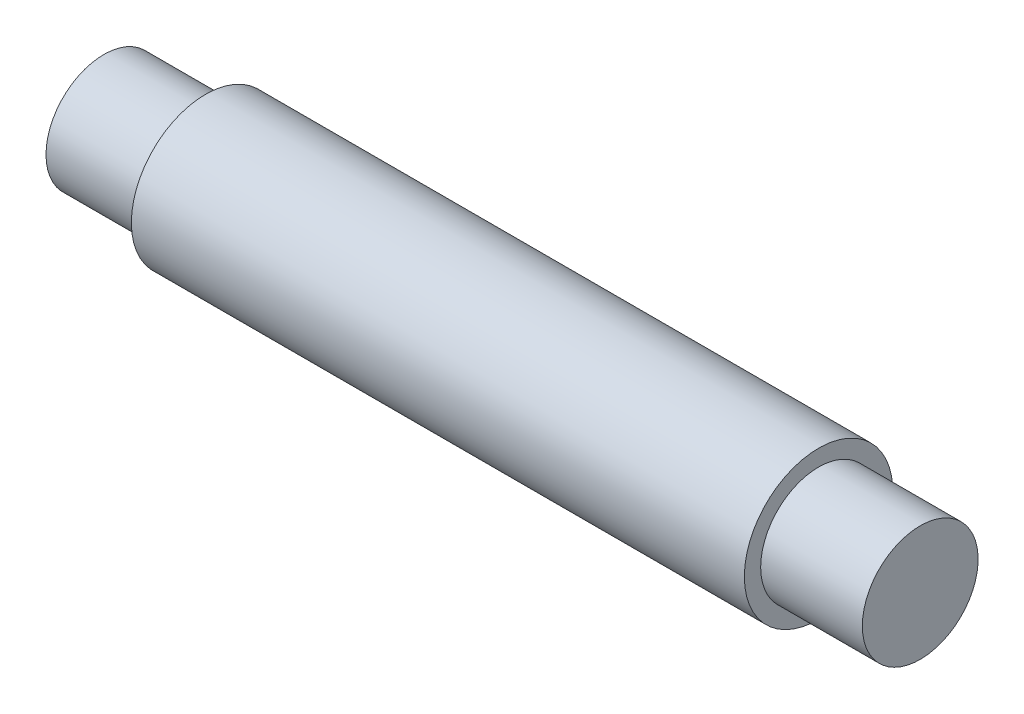
from build123d import *

# Parameters (mm, degrees)
SKETCH1_W = 6.85
SKETCH1_H = 3.9


with BuildPart() as part:
    # Sketch1 → Revolve1 (revolve)
    with BuildSketch(Plane.XY, mode=Mode.PRIVATE) as revolve1_sk:
        Polygon((20.65, 5), (-20.65, 5), (-20.65, 3.9), (-20.65, 0), (20.65, 0), (20.65, 3.9), align=None)
        with Locations((-24.075, 1.95)):
            Rectangle(SKETCH1_W, SKETCH1_H)
        with Locations((24.075, 1.95)):
            Rectangle(SKETCH1_W, SKETCH1_H)
    revolve(revolve1_sk.sketch.rotate(Axis((-27.5, 0, 0), (1, 0, 0)), 90), axis=Axis((-27.5, 0, 0), (1, 0, 0)))


solid = part.part
